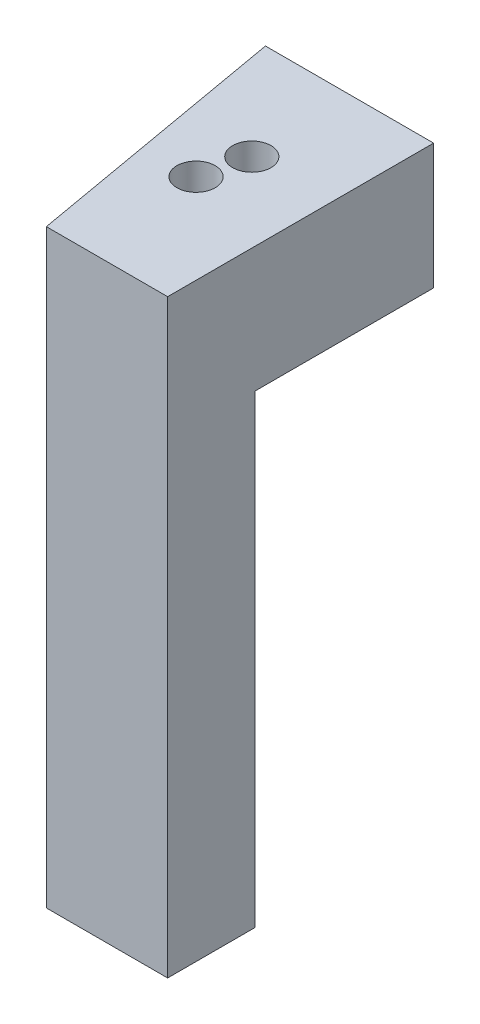
from build123d import *

# Parameters (mm, degrees)
BOSS_EXTRUDE1_DEPTH = 50.8
CUT_EXTRUDE1_DEPTH  = 40
CUT_EXTRUDE2_DEPTH  = 50.8
SKETCH4_R           = 1.65
CUT_EXTRUDE3_DEPTH  = 25.4


with BuildPart() as part:
    # Sketch1 → Boss-Extrude1 (new body)
    with BuildSketch(Plane(origin=(0, 0, 0), x_dir=(1, 0, 0), z_dir=(0, 1, 0))):
        Polygon((0, 0), (-4.47870531, 25.4), (10, 25.4), (10, 0), align=None)
    extrude(amount=BOSS_EXTRUDE1_DEPTH)

    # Sketch2 → Cut-Extrude1 (cut)
    with BuildSketch(Plane.XZ):
        Polygon((10, -25.4), (-4.47870531, -25.4), (-1.763269807, -10), (10, -10), align=None)
    extrude(amount=-CUT_EXTRUDE1_DEPTH, mode=Mode.SUBTRACT)

    # Sketch3 → Cut-Extrude2 (cut)
    with BuildSketch(Plane(origin=(0, 0, 0), x_dir=(-1, 0, 0), z_dir=(0, -1, 0))):
        Polygon((-10, 2.5), (0.440817452, 2.5), (0, 0), (-10, 0), align=None)
    extrude(amount=-CUT_EXTRUDE2_DEPTH, mode=Mode.SUBTRACT)

    # Sketch4 → Cut-Extrude3 (cut)
    with BuildSketch(Plane(origin=(0, 40, 0), x_dir=(-1, 0, 0), z_dir=(0, -1, 0))):
        with Locations(Location((-3.18210765, 16.56485457, 0), (0, 0, 90))):
            Circle(SKETCH4_R)
        with Locations(Location((-2.278142793, 12.66833721, 0), (0, 0, 90))):
            Circle(SKETCH4_R)
    extrude(amount=-CUT_EXTRUDE3_DEPTH, mode=Mode.SUBTRACT)


solid = part.part
